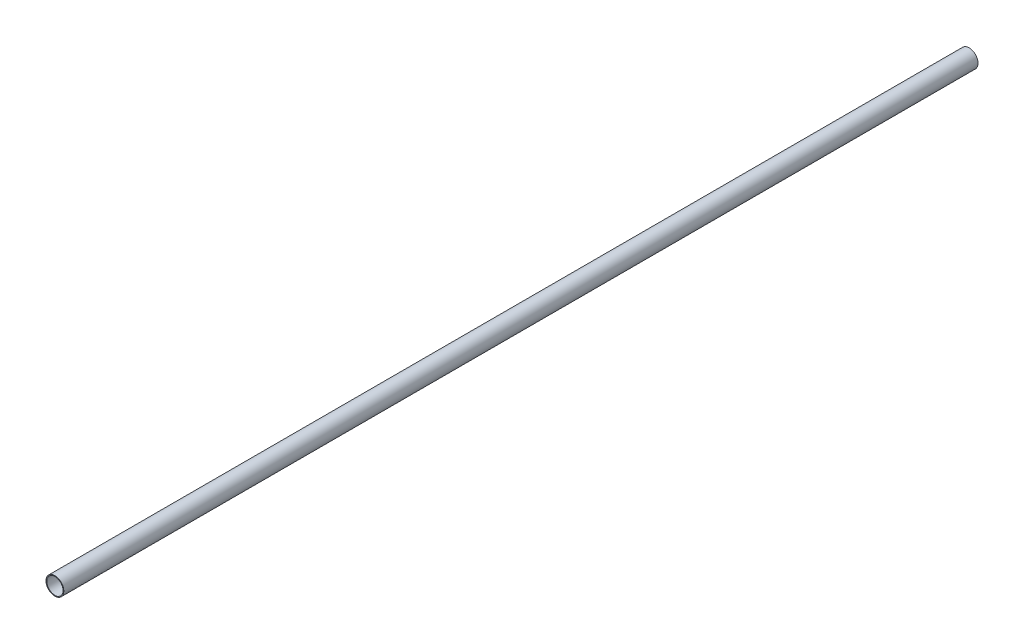
from build123d import *

# Parameters (mm, degrees)
SKETCH1_R           = 84.1375
SKETCH1_R_2         = 77.0255
BOSS_EXTRUDE1_DEPTH = 8630


with BuildPart() as part:
    # Sketch1 → Boss-Extrude1 (new body)
    with BuildSketch(Plane.XY):
        Circle(SKETCH1_R)
        Circle(SKETCH1_R_2, mode=Mode.SUBTRACT)
    extrude(amount=BOSS_EXTRUDE1_DEPTH)


solid = part.part
